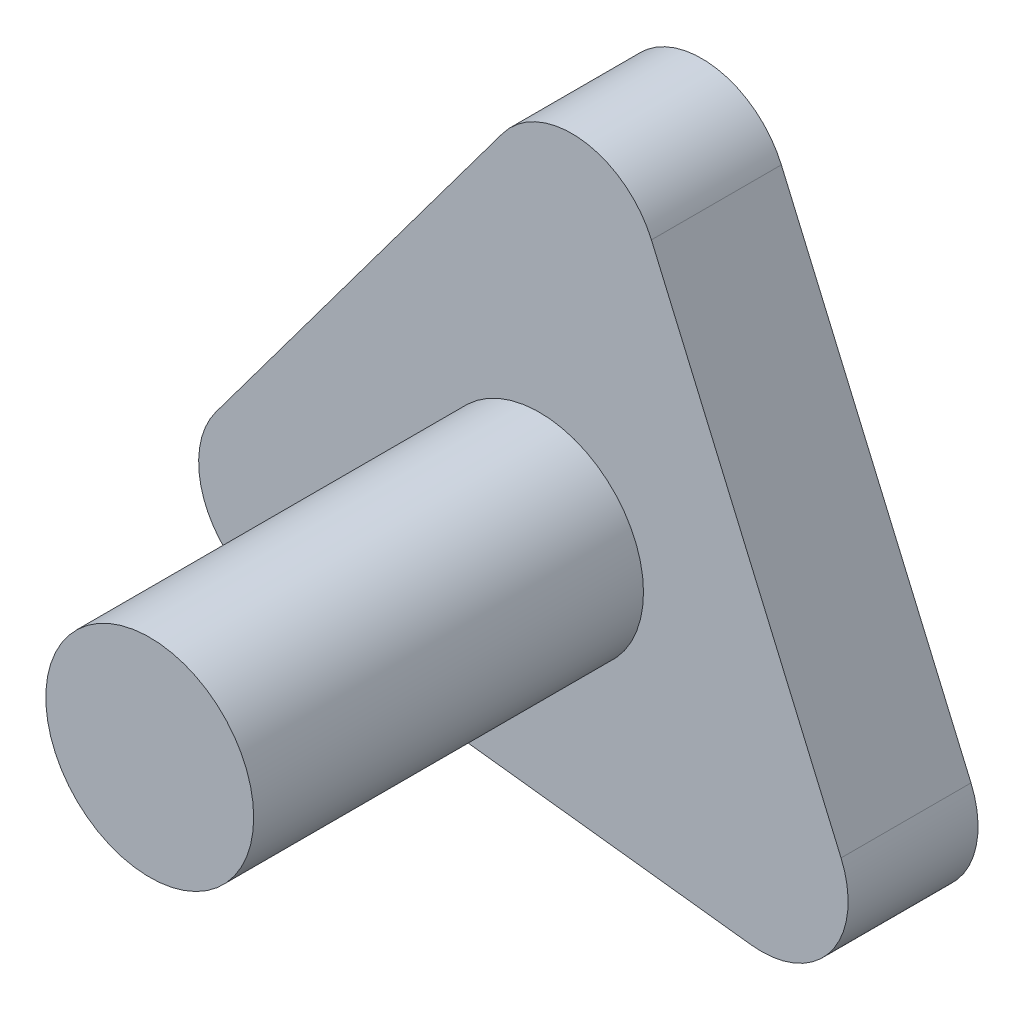
from build123d import *

# Parameters (mm, degrees)
SKETCH_1_R      = 2.4
EXTRUDE_1_DEPTH = 9
EXTRUDE_2_DEPTH = 3
FILLET_2_R      = 2
FILLET_3_R      = 2
FILLET_4_R      = 2


with BuildPart() as part:
    # 草图1 → 凸台-拉伸1 (new body)
    with BuildSketch(Plane.XY):
        Circle(SKETCH_1_R)
    extrude(amount=EXTRUDE_1_DEPTH)

    # 草图2 → 凸台-拉伸2 (add)
    with BuildSketch(Plane(origin=(0, 0, 0), x_dir=(-1, 0, 0), z_dir=(0, 0, -1))):
        Polygon((9.54506031, -4.109966384), (-1.213194857, 10.321247901), (-8.331865453, -6.211281517), align=None)
    extrude(amount=EXTRUDE_2_DEPTH)

    # 圆角2
    fillet_2_edges = [part.edges().sort_by_distance(p)[0] for p in [
        (-9.54506031, -4.109966384, -1.5),
    ]]
    fillet(fillet_2_edges, radius=FILLET_2_R)

    # 圆角3
    fillet_3_edges = [part.edges().sort_by_distance(p)[0] for p in [
        (1.213194857, 10.321247901, -1.5),
    ]]
    fillet(fillet_3_edges, radius=FILLET_3_R)

    # 圆角4
    fillet_4_edges = [part.edges().sort_by_distance(p)[0] for p in [
        (8.331865453, -6.211281517, -1.5),
    ]]
    fillet(fillet_4_edges, radius=FILLET_4_R)


solid = part.part
